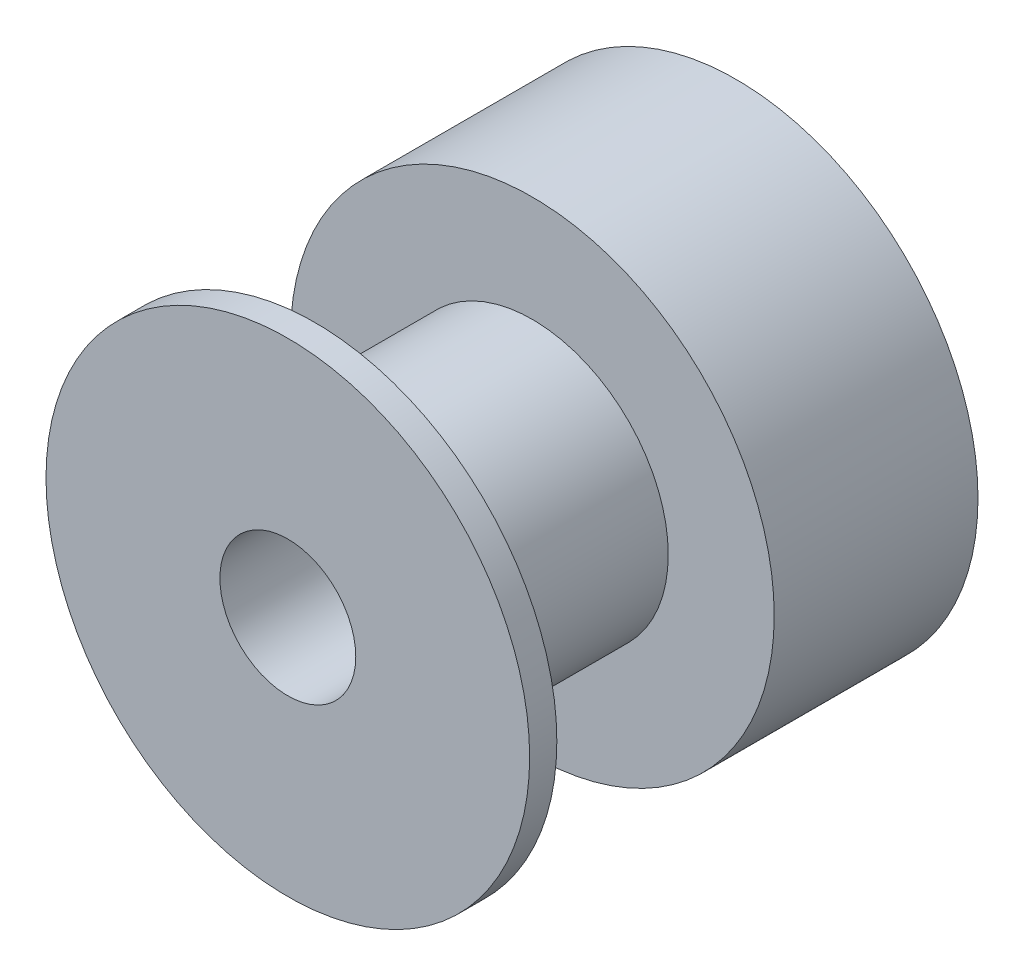
from build123d import *

# Parameters (mm, degrees)
SKETCH1_R           = 8.9
SKETCH1_R_2         = 2.5
BOSS_EXTRUDE1_DEPTH = 16.5
CUT_EXTRUDE1_START  = -9
SKETCH2_R           = 8.9
SKETCH2_R_2         = 5
CUT_EXTRUDE1_DEPTH  = 8


with BuildPart() as part:
    # Sketch1 → Boss-Extrude1 (new body)
    with BuildSketch(Plane.XY):
        Circle(SKETCH1_R)
        Circle(SKETCH1_R_2, mode=Mode.SUBTRACT)
    extrude(amount=BOSS_EXTRUDE1_DEPTH)

    # Sketch2 → Cut-Extrude1 (cut)
    with BuildSketch(Plane.XY.offset(16.5).offset(CUT_EXTRUDE1_START)):
        Circle(SKETCH2_R)
        Circle(SKETCH2_R_2, mode=Mode.SUBTRACT)
    extrude(amount=CUT_EXTRUDE1_DEPTH, mode=Mode.SUBTRACT)


solid = part.part
